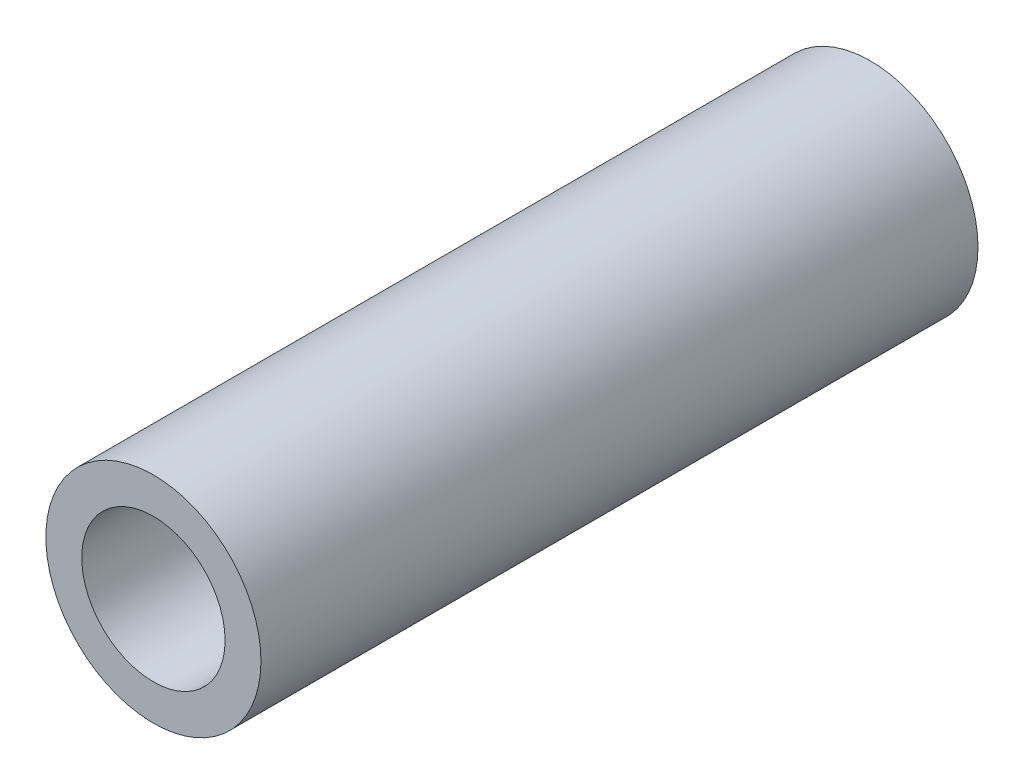
from build123d import *

# Parameters (mm, degrees)
EXTRUDE_1_DEPTH      = 30
EXTRUDE_1_DEPTH_BACK = 30
SKETCH_1_R           = 9
SKETCH_1_R_2         = 6


with BuildPart() as part:
    # Эскиз1 → Вытянуть-Тонкостенный1 (new, two sides: drawn at the far end of the back side and taken through both)
    with BuildSketch(Plane.XY.offset(-EXTRUDE_1_DEPTH_BACK)):
        Circle(SKETCH_1_R)
        Circle(SKETCH_1_R_2, mode=Mode.SUBTRACT)
    extrude(amount=EXTRUDE_1_DEPTH + EXTRUDE_1_DEPTH_BACK)


solid = part.part
